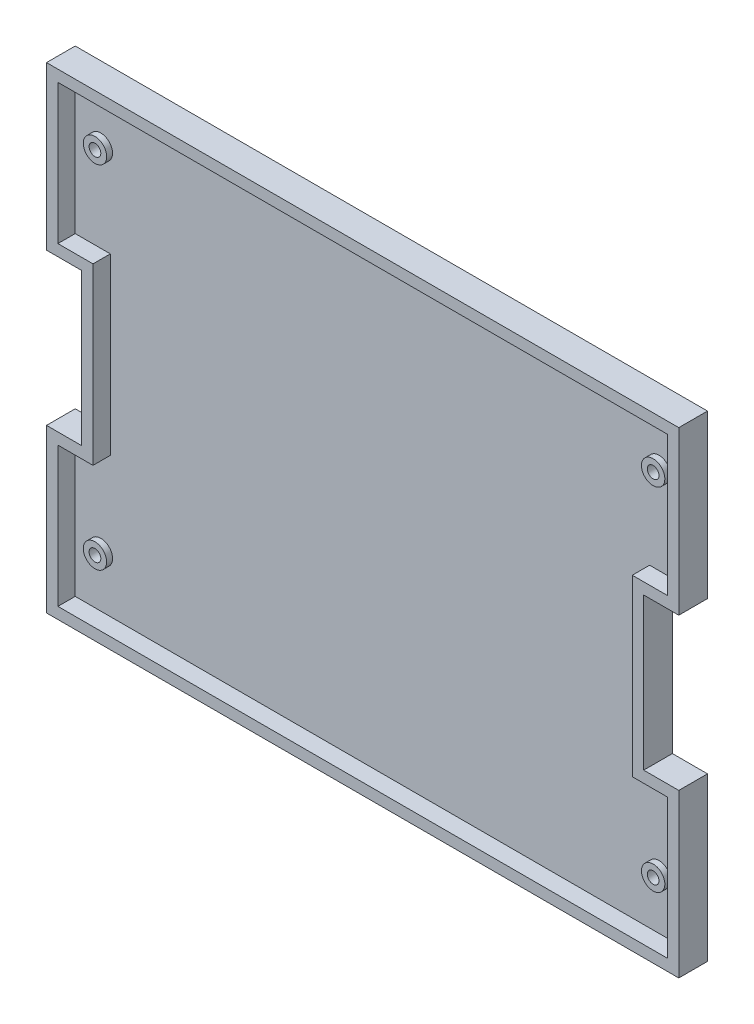
from build123d import *

# Parameters (mm, degrees)
SALIENTE_EXTRUIR1_DEPTH    = 4.91
VACIADO1_T                 = -1.95
CROQUIS3_R                 = 2
SALIENTE_EXTRUIR3_DEPTH    = 2.96
CORTAR_EXTRUIR1_DEPTH      = 68.872038609
CORTAR_EXTRUIR1_DEPTH_BACK = 2.96
CROQUIS4_R                 = 1


with BuildPart() as part:
    # Croquis1 → Saliente-Extruir1 (new body)
    with BuildSketch(Plane.XY):
        Polygon((-54.055, -12.97), (-54.055, -40.75), (54.055, -40.75), (54.055, -12.97), (48.055, -12.97), (48.055, 12.97), (54.055, 12.97), (54.055, 40.75), (-54.055, 40.75), (-54.055, 12.97), (-48.055, 12.97), (-48.055, -12.97), align=None)
    extrude(amount=SALIENTE_EXTRUIR1_DEPTH)

    # Vaciado1
    vaciado1_openings = [part.faces().sort_by_distance(p)[0] for p in [
        (0, 0, 4.91),
    ]]
    offset(amount=VACIADO1_T, openings=vaciado1_openings, kind=Kind.INTERSECTION)

    # Croquis3 → Saliente-Extruir3 (add)
    with BuildSketch(Plane.XY):
        with Locations((-47.72, 30.01)):
            Circle(CROQUIS3_R)
        with Locations(Location((47.72, 30.01, 0), (0, 0, 180))):
            Circle(CROQUIS3_R)
        with Locations((47.72, -30.01)):
            Circle(CROQUIS3_R)
        with Locations(Location((-47.72, -30.01, 0), (0, 0, 180))):
            Circle(CROQUIS3_R)
    extrude(amount=SALIENTE_EXTRUIR3_DEPTH)

    # Croquis4 → Cortar-Extruir1 (cut, two sides: drawn at the far end of the back side and taken through both)
    with BuildSketch(Plane.XY.offset(-CORTAR_EXTRUIR1_DEPTH_BACK)):
        with Locations((-47.72, 30.01)):
            Circle(CROQUIS4_R)
        with Locations(Location((47.72, 30.01, 0), (0, 0, 180))):
            Circle(CROQUIS4_R)
        with Locations((47.72, -30.01)):
            Circle(CROQUIS4_R)
        with Locations(Location((-47.72, -30.01, 0), (0, 0, 180))):
            Circle(CROQUIS4_R)
    extrude(amount=CORTAR_EXTRUIR1_DEPTH + CORTAR_EXTRUIR1_DEPTH_BACK, mode=Mode.SUBTRACT)


solid = part.part
